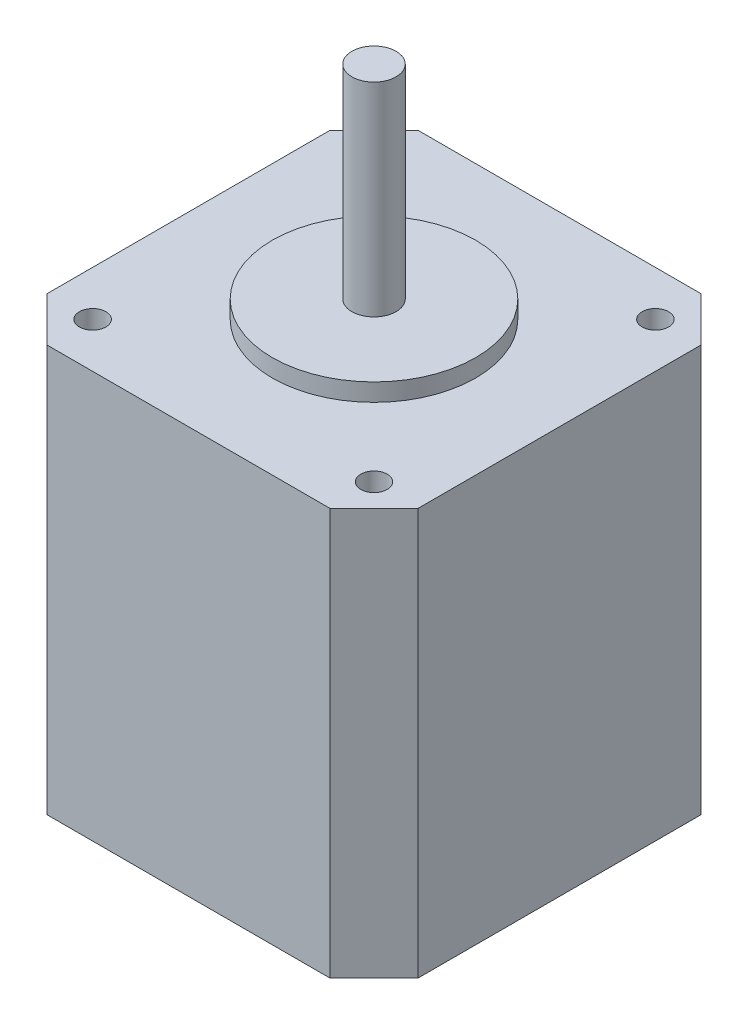
from build123d import *

# Parameters (mm, degrees)
SKETCH1_W           = 42
SKETCH1_H           = 42
BOSS_EXTRUDE1_DEPTH = 46
CHAMFER1_SIZE       = 5
SKETCH2_R           = 11.5
BOSS_EXTRUDE2_DEPTH = 2
SKETCH3_R           = 2.5
BOSS_EXTRUDE3_DEPTH = 25
SKETCH4_R           = 1.5
CUT_EXTRUDE1_DEPTH  = 5


with BuildPart() as part:
    # Sketch1 → Boss-Extrude1 (new body)
    with BuildSketch(Plane(origin=(0, 0, 0), x_dir=(1, 0, 0), z_dir=(0, 1, 0))):
        Rectangle(SKETCH1_W, SKETCH1_H)
    extrude(amount=BOSS_EXTRUDE1_DEPTH)

    # Chamfer1
    chamfer1_edges = [part.edges().sort_by_distance(p)[0] for p in [
        (21, 23, 21),
        (-21, 23, 21),
        (-21, 23, -21),
        (21, 23, -21),
    ]]
    chamfer(chamfer1_edges, length=CHAMFER1_SIZE)

    # Sketch2 → Boss-Extrude2 (add)
    with BuildSketch(Plane(origin=(0, 46, 0), x_dir=(1, 0, 0), z_dir=(0, 1, 0))):
        with Locations(Location((0, 0, 0), (0, 0, 90))):
            Circle(SKETCH2_R)
    extrude(amount=BOSS_EXTRUDE2_DEPTH)

    # Sketch3 → Boss-Extrude3 (add)
    with BuildSketch(Plane(origin=(0, 46, 0), x_dir=(1, 0, 0), z_dir=(0, 1, 0))):
        with Locations(Location((0, 0, 0), (0, 0, 270))):
            Circle(SKETCH3_R)
    extrude(amount=BOSS_EXTRUDE3_DEPTH)

    # Sketch4 → Cut-Extrude1 (cut)
    with BuildSketch(Plane(origin=(0, 46, 0), x_dir=(1, 0, 0), z_dir=(0, 1, 0))):
        with Locations(Location((-15.909902577, 15.909902577, 0), (0, 0, 270))):
            Circle(SKETCH4_R)
        with Locations(Location((15.909902577, 15.909902577, 0), (0, 0, 270))):
            Circle(SKETCH4_R)
        with Locations(Location((15.909902577, -15.909902577, 0), (0, 0, 270))):
            Circle(SKETCH4_R)
        with Locations(Location((-15.909902577, -15.909902577, 0), (0, 0, 270))):
            Circle(SKETCH4_R)
    extrude(amount=-CUT_EXTRUDE1_DEPTH, mode=Mode.SUBTRACT)


solid = part.part
